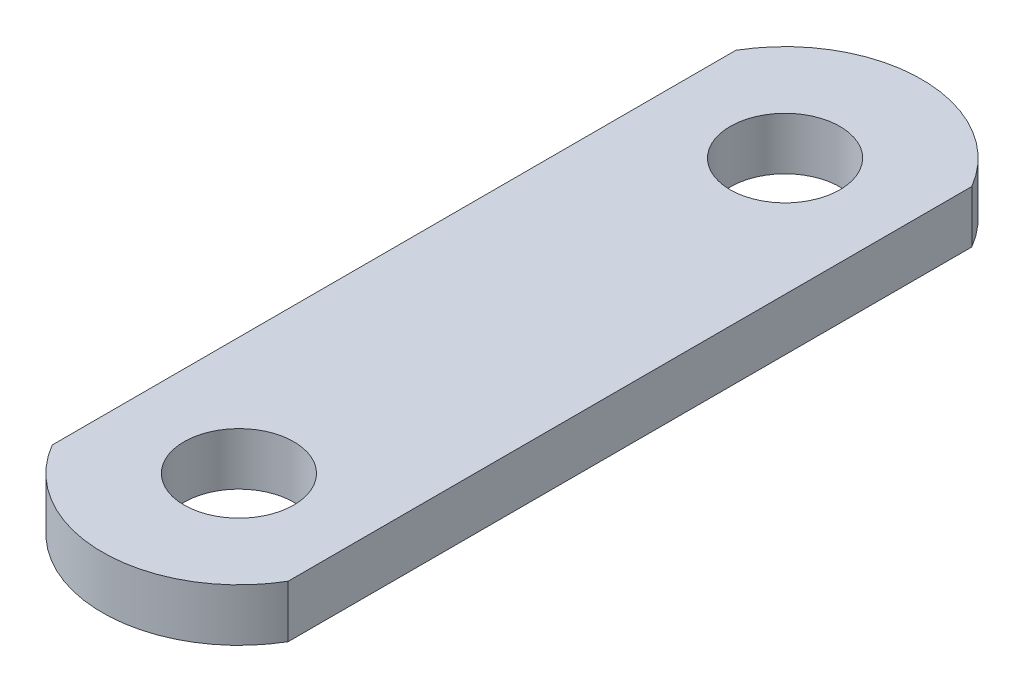
from build123d import *

# Parameters (mm, degrees)
SKETCH1_W               = 10.9728
SKETCH1_H               = 2.4384
EXTRUDE1_DEPTH          = 38.1
F_1_4_20_TAPPED_HOLE1_D = 5.1054
CUT_EXTRUDE1_DEPTH      = 40.723521173


with BuildPart() as part:
    # Sketch1 → Extrude1 (new body)
    with BuildSketch(Plane.XY):
        with Locations((5.4864, 1.2192)):
            Rectangle(SKETCH1_W, SKETCH1_H)
    extrude(amount=EXTRUDE1_DEPTH)

    # 1/4-20 Tapped Hole1 (through all)
    with Locations(Plane(origin=(5.4864, 2.4384, 6.35), x_dir=(0, 0, 1), z_dir=(0, 1, 0))):
        with Locations((0, 0), (25.4, 0)):
            Hole(F_1_4_20_TAPPED_HOLE1_D / 2)

    # Sketch4 → Cut-Extrude1 (cut, through all)
    with BuildSketch(Plane(origin=(0, 2.4384, 0), x_dir=(-1, 0, 0), z_dir=(0, 1, 0))):
        with BuildLine():
            ThreePointArc((-5.4864, 0), (-8.651032451, 0.844765995), (-10.97365738, 3.154298755))
            Line((-10.97365738, 3.154298755), (-10.9728, 0))
            Line((-10.9728, 0), (-5.4864, 0))
        make_face()
        with BuildLine():
            ThreePointArc((0, 3.152827024), (-2.322505912, 0.84434162), (-5.4864, 0))
            Line((-5.4864, 0), (0, 0))
            Line((0, 0), (0, 3.152827024))
        make_face()
        with BuildLine():
            Line((0, 38.1), (-5.4864, 38.1))
            ThreePointArc((-5.4864, 38.1), (-2.322505912, 37.25565838), (0, 34.947172976))
            Line((0, 34.947172976), (0, 38.1))
        make_face()
        with BuildLine():
            Line((-10.9728, 38.1), (-10.97365738, 34.945701245))
            ThreePointArc((-10.97365738, 34.945701245), (-8.651032451, 37.255234005), (-5.4864, 38.1))
            Line((-5.4864, 38.1), (-10.9728, 38.1))
        make_face()
    extrude(amount=-CUT_EXTRUDE1_DEPTH, mode=Mode.SUBTRACT)


solid = part.part
